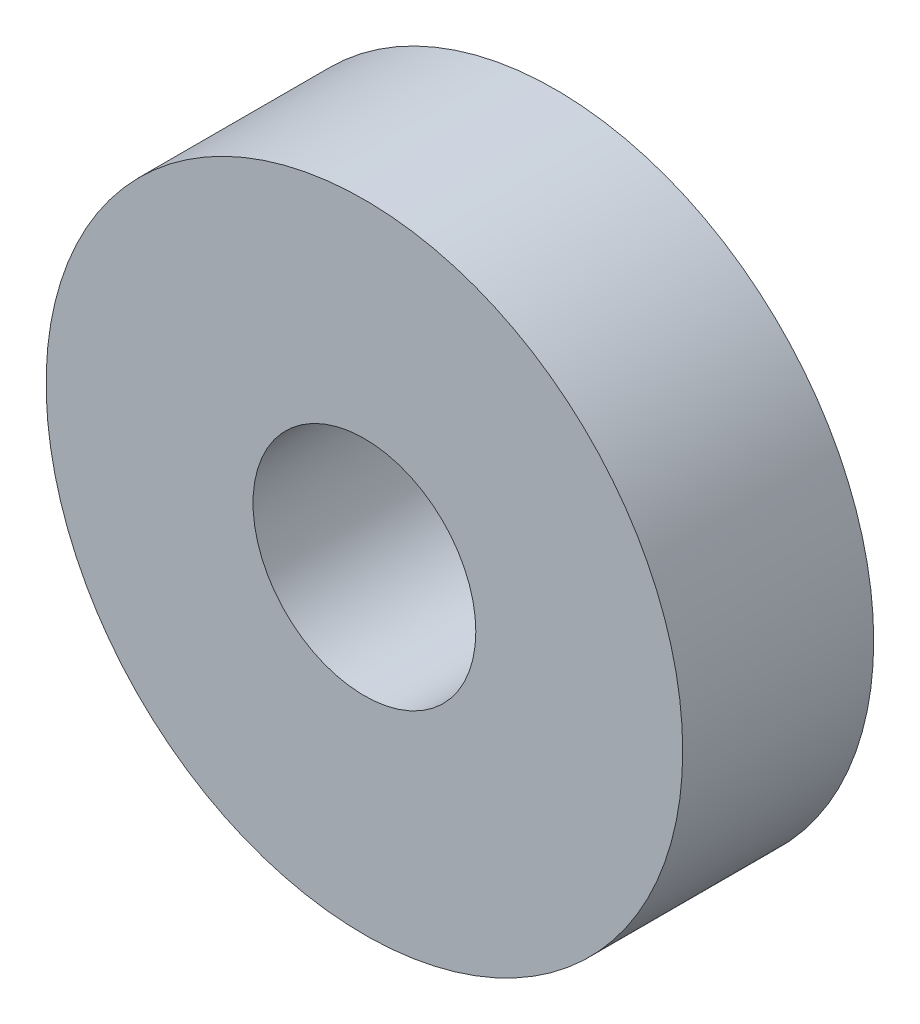
from build123d import *

# Parameters (mm, degrees)
SKETCH2_R           = 5
SKETCH2_R_2         = 1.75
BOSS_EXTRUDE1_DEPTH = 3


with BuildPart() as part:
    # Sketch2 → Boss-Extrude1 (new body)
    with BuildSketch(Plane.XY):
        Circle(SKETCH2_R)
        Circle(SKETCH2_R_2, mode=Mode.SUBTRACT)
    extrude(amount=BOSS_EXTRUDE1_DEPTH)


solid = part.part
